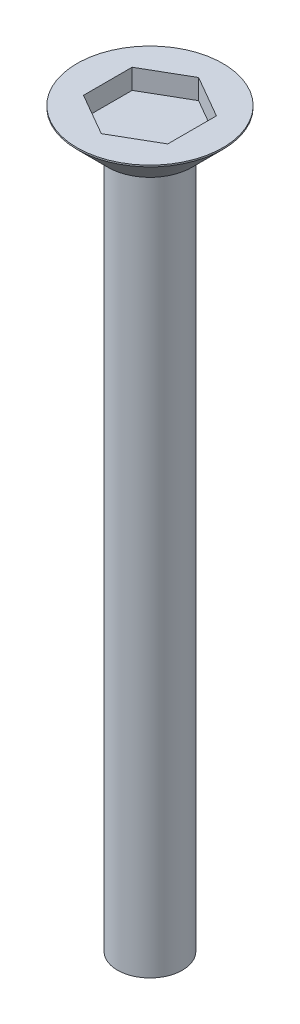
from build123d import *

# Parameters (mm, degrees)
SKETCH1_R     = 2
LENGTH_DEPTH  = 43.18
SKETCH2_R     = 4.5
CAP_DEPTH     = 2
HEX_CUT_DEPTH = 1.238
CHAMFER1_SIZE = 1.905


with BuildPart() as part:
    # Sketch1 → Length (new body)
    with BuildSketch(Plane(origin=(0, 0, 0), x_dir=(1, 0, 0), z_dir=(0, 1, 0))):
        with Locations(Location((0, 0, 0), (0, 0, 270))):
            Circle(SKETCH1_R)
    extrude(amount=LENGTH_DEPTH)

    # Sketch2 → Cap (add)
    with BuildSketch(Plane(origin=(0, 43.18, 0), x_dir=(1, 0, 0), z_dir=(0, 1, 0))):
        with Locations(Location((0, 0, 0), (0, 0, 270))):
            Circle(SKETCH2_R)
    extrude(amount=CAP_DEPTH)

    # Sketch3 → Hex cut (cut)
    with BuildSketch(Plane(origin=(0, 45.18, 0), x_dir=(1, 0, 0), z_dir=(0, 1, 0))):
        Polygon((0, 3), (-2.598076211, 1.5), (-2.598076211, -1.5), (0, -3), (2.598076211, -1.5), (2.598076211, 1.5), align=None)
    extrude(amount=-HEX_CUT_DEPTH, mode=Mode.SUBTRACT)

    # Chamfer1
    chamfer1_edges = [part.edges().sort_by_distance(p)[0] for p in [
        (0, 43.18, -4.5),
    ]]
    chamfer(chamfer1_edges, length=CHAMFER1_SIZE)


solid = part.part
